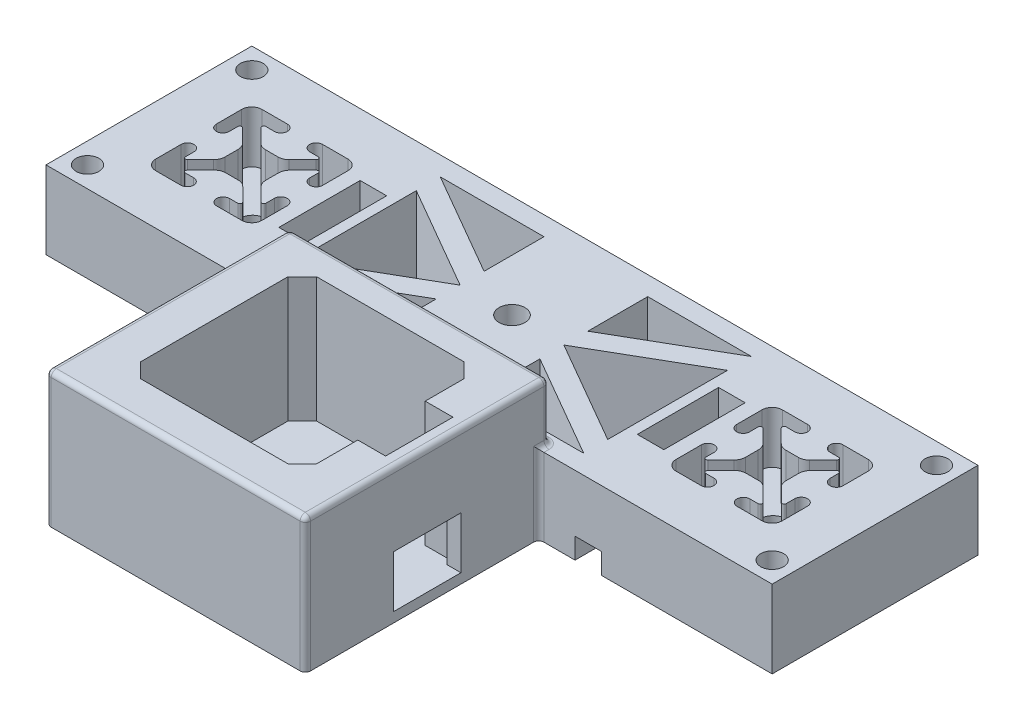
from build123d import *

# Parameters (mm, degrees)
SKETCH1_W               = 177.8
SKETCH1_H               = 50.4000008
BOSS_EXTRUDE1_DEPTH     = 6.35
SKETCH2_W               = 177.8
SKETCH2_H               = 50.4000008
BOSS_EXTRUDE2_DEPTH     = 12.7
SKETCH3_R               = 3.175
CUT_EXTRUDE1_DEPTH      = 186.784559586
CUT_EXTRUDE2_DEPTH      = 186.784559586
SKETCH5_W               = 6.5
SKETCH5_H               = 19.9
CUT_EXTRUDE3_DEPTH      = 10.2
SKETCH6_W               = 6.5
SKETCH6_H               = 4.572
CUT_EXTRUDE4_DEPTH      = 186.086574555
CUT_EXTRUDE5_DEPTH      = 186.241167349
CUT_EXTRUDE5_DEPTH_BACK = 186.241167349
SKETCH7_R               = 2.921
CUT_EXTRUDE6_DEPTH      = 186.241167349
CUT_EXTRUDE6_DEPTH_BACK = 186.241167349
SKETCH8_R               = 2.921
CHAMFER2_SIZE           = 3.302
CHAMFER3_SIZE           = 3.302
CUT_EXTRUDE8_DEPTH      = 5.08
BOSS_EXTRUDE4_DEPTH     = 33.02
CUT_EXTRUDE9_DEPTH      = 30.6
SKETCH13_W              = 16.5
SKETCH13_H              = 12.7
CUT_EXTRUDE10_DEPTH     = 30.6
FILLET1_R               = 1.27
SKETCH14_R              = 2.921
CUT_EXTRUDE11_DEPTH     = 190.249365917
SKETCH15_R              = 10.16
CUT_EXTRUDE12_DEPTH     = 8.128
SKETCH16_R              = 2.794
CUT_EXTRUDE13_DEPTH     = 188.728167838


with BuildPart() as part:
    # Sketch1 → Boss-Extrude1 (new body)
    with BuildSketch(Plane(origin=(0, 0, 0), x_dir=(1, 0, 0), z_dir=(0, 1, 0))):
        with Locations((88.9, 25.2000004)):
            Rectangle(SKETCH1_W, SKETCH1_H)
    extrude(amount=BOSS_EXTRUDE1_DEPTH)

    # Sketch2 → Boss-Extrude2 (add)
    with BuildSketch(Plane(origin=(0, 6.35, 0), x_dir=(1, 0, 0), z_dir=(0, 1, 0))):
        with Locations((88.9, 25.2000004)):
            Rectangle(SKETCH2_W, SKETCH2_H)
        with BuildLine():
            Line((38.207602115, 29.52001185), (38.207602115, 35.7371571))
            ThreePointArc((38.207602115, 35.7371571), (37.48390875, 37.484307436), (35.736758415, 38.2080008))
            Line((35.736758415, 38.2080008), (29.519613165, 38.2080008))
            ThreePointArc((29.519613165, 38.2080008), (27.941613165, 36.6300008), (29.519613165, 35.0520008))
            Line((29.519613165, 35.0520008), (31.618952135, 35.0520008))
            ThreePointArc((31.618952135, 35.0520008), (32.082805957, 34.741944038), (31.973665066, 34.194784253))
            Line((31.973665066, 34.194784253), (28.637609194, 30.863479703))
            ThreePointArc((28.637609194, 30.863479703), (27.774459736, 30.287408726), (26.756632806, 30.085138862))
            Line((26.756632806, 30.085138862), (23.642969309, 30.085138862))
            ThreePointArc((23.642969309, 30.085138862), (22.625142379, 30.287408726), (21.761992921, 30.863479703))
            Line((21.761992921, 30.863479703), (18.425937049, 34.194784253))
            ThreePointArc((18.425937049, 34.194784253), (18.316796158, 34.741944038), (18.78064998, 35.0520008))
            Line((18.78064998, 35.0520008), (20.87998895, 35.0520008))
            ThreePointArc((20.87998895, 35.0520008), (22.45798895, 36.6300008), (20.87998895, 38.2080008))
            Line((20.87998895, 38.2080008), (14.6628437, 38.2080008))
            ThreePointArc((14.6628437, 38.2080008), (12.915693364, 37.484307436), (12.192, 35.7371571))
            Line((12.192, 35.7371571), (12.192, 29.52001185))
            ThreePointArc((12.192, 29.52001185), (13.77, 27.94201185), (15.348, 29.52001185))
            Line((15.348, 29.52001185), (15.348, 31.596493464))
            ThreePointArc((15.348, 31.596493464), (15.657726258, 32.060210386), (16.204710632, 31.95171231))
            Line((16.204710632, 31.95171231), (19.406929995, 28.754053655))
            ThreePointArc((19.406929995, 28.754053655), (20.019806023, 27.837880259), (20.235040084, 26.756832148))
            Line((20.235040084, 26.756832148), (20.235040084, 23.643168652))
            ThreePointArc((20.235040084, 23.643168652), (20.019806023, 22.562120541), (19.406929995, 21.645947145))
            Line((19.406929995, 21.645947145), (16.204710632, 18.44828849))
            ThreePointArc((16.204710632, 18.44828849), (15.657726258, 18.339790414), (15.348, 18.803507336))
            Line((15.348, 18.803507336), (15.348, 20.87998895))
            ThreePointArc((15.348, 20.87998895), (13.77, 22.45798895), (12.192, 20.87998895))
            Line((12.192, 20.87998895), (12.192, 14.6628437))
            ThreePointArc((12.192, 14.6628437), (12.915693364, 12.915693364), (14.6628437, 12.192))
            Line((14.6628437, 12.192), (20.812064149, 12.192))
            ThreePointArc((20.812064149, 12.192), (22.390064149, 13.77), (20.812064149, 15.348))
            Line((20.812064149, 15.348), (18.78064998, 15.348))
            ThreePointArc((18.78064998, 15.348), (18.316796158, 15.658056762), (18.425937049, 16.205216547))
            Line((18.425937049, 16.205216547), (21.761992921, 19.536521097))
            ThreePointArc((21.761992921, 19.536521097), (22.625142379, 20.112592074), (23.642969309, 20.314861938))
            Line((23.642969309, 20.314861938), (26.756632806, 20.314861938))
            ThreePointArc((26.756632806, 20.314861938), (27.774459736, 20.112592074), (28.637609194, 19.536521097))
            Line((28.637609194, 19.536521097), (31.973665066, 16.205216547))
            ThreePointArc((31.973665066, 16.205216547), (32.082805957, 15.658056762), (31.618952135, 15.348))
            Line((31.618952135, 15.348), (29.587537966, 15.348))
            ThreePointArc((29.587537966, 15.348), (28.009537966, 13.77), (29.587537966, 12.192))
            Line((29.587537966, 12.192), (35.736758415, 12.192))
            ThreePointArc((35.736758415, 12.192), (37.48390875, 12.915693364), (38.207602115, 14.6628437))
            Line((38.207602115, 14.6628437), (38.207602115, 20.87998895))
            ThreePointArc((38.207602115, 20.87998895), (36.629602115, 22.45798895), (35.051602115, 20.87998895))
            Line((35.051602115, 20.87998895), (35.051602115, 18.803507336))
            ThreePointArc((35.051602115, 18.803507336), (34.741875857, 18.339790414), (34.194891482, 18.44828849))
            Line((34.194891482, 18.44828849), (30.99267212, 21.645947145))
            ThreePointArc((30.99267212, 21.645947145), (30.379796092, 22.562120541), (30.16456203, 23.643168652))
            Line((30.16456203, 23.643168652), (30.16456203, 26.756832148))
            ThreePointArc((30.16456203, 26.756832148), (30.379796092, 27.837880259), (30.99267212, 28.754053655))
            Line((30.99267212, 28.754053655), (34.194891482, 31.95171231))
            ThreePointArc((34.194891482, 31.95171231), (34.741875857, 32.060210386), (35.051602115, 31.596493464))
            Line((35.051602115, 31.596493464), (35.051602115, 29.52001185))
            ThreePointArc((35.051602115, 29.52001185), (36.629602115, 27.94201185), (38.207602115, 29.52001185))
        make_face(mode=Mode.SUBTRACT)
        with BuildLine():
            Line((142.748397885, 31.596493464), (142.748397885, 29.52001185))
            ThreePointArc((142.748397885, 29.52001185), (141.170397885, 27.94201185), (139.592397885, 29.52001185))
            Line((139.592397885, 29.52001185), (139.592397885, 35.7371571))
            ThreePointArc((139.592397885, 35.7371571), (140.31609125, 37.484307436), (142.063241585, 38.2080008))
            Line((142.063241585, 38.2080008), (148.280386835, 38.2080008))
            ThreePointArc((148.280386835, 38.2080008), (149.858386835, 36.6300008), (148.280386835, 35.0520008))
            Line((148.280386835, 35.0520008), (146.181047865, 35.0520008))
            ThreePointArc((146.181047865, 35.0520008), (145.717194043, 34.741944038), (145.826334934, 34.194784253))
            Line((145.826334934, 34.194784253), (149.162390806, 30.863479703))
            ThreePointArc((149.162390806, 30.863479703), (150.025540264, 30.287408726), (151.043367194, 30.085138862))
            Line((151.043367194, 30.085138862), (154.157030691, 30.085138862))
            ThreePointArc((154.157030691, 30.085138862), (155.174857621, 30.287408726), (156.038007079, 30.863479703))
            Line((156.038007079, 30.863479703), (159.374062951, 34.194784253))
            ThreePointArc((159.374062951, 34.194784253), (159.483203842, 34.741944038), (159.01935002, 35.0520008))
            Line((159.01935002, 35.0520008), (156.92001105, 35.0520008))
            ThreePointArc((156.92001105, 35.0520008), (155.34201105, 36.6300008), (156.92001105, 38.2080008))
            Line((156.92001105, 38.2080008), (163.1371563, 38.2080008))
            ThreePointArc((163.1371563, 38.2080008), (164.884306636, 37.484307436), (165.608, 35.7371571))
            Line((165.608, 35.7371571), (165.608, 29.52001185))
            ThreePointArc((165.608, 29.52001185), (164.03, 27.94201185), (162.452, 29.52001185))
            Line((162.452, 29.52001185), (162.452, 31.596493464))
            ThreePointArc((162.452, 31.596493464), (162.142273742, 32.060210386), (161.595289368, 31.95171231))
            Line((161.595289368, 31.95171231), (158.393070005, 28.754053655))
            ThreePointArc((158.393070005, 28.754053655), (157.780193977, 27.837880259), (157.564959916, 26.756832148))
            Line((157.564959916, 26.756832148), (157.564959916, 23.643168652))
            ThreePointArc((157.564959916, 23.643168652), (157.780193977, 22.562120541), (158.393070005, 21.645947145))
            Line((158.393070005, 21.645947145), (161.595289368, 18.44828849))
            ThreePointArc((161.595289368, 18.44828849), (162.142273742, 18.339790414), (162.452, 18.803507336))
            Line((162.452, 18.803507336), (162.452, 20.87998895))
            ThreePointArc((162.452, 20.87998895), (164.03, 22.45798895), (165.608, 20.87998895))
            Line((165.608, 20.87998895), (165.608, 14.6628437))
            ThreePointArc((165.608, 14.6628437), (164.884306636, 12.915693364), (163.1371563, 12.192))
            Line((163.1371563, 12.192), (156.987935851, 12.192))
            ThreePointArc((156.987935851, 12.192), (155.409935851, 13.77), (156.987935851, 15.348))
            Line((156.987935851, 15.348), (159.01935002, 15.348))
            ThreePointArc((159.01935002, 15.348), (159.483203842, 15.658056762), (159.374062951, 16.205216547))
            Line((159.374062951, 16.205216547), (156.038007079, 19.536521097))
            ThreePointArc((156.038007079, 19.536521097), (155.174857621, 20.112592074), (154.157030691, 20.314861938))
            Line((154.157030691, 20.314861938), (151.043367194, 20.314861938))
            ThreePointArc((151.043367194, 20.314861938), (150.025540264, 20.112592074), (149.162390806, 19.536521097))
            Line((149.162390806, 19.536521097), (145.826334934, 16.205216547))
            ThreePointArc((145.826334934, 16.205216547), (145.717194043, 15.658056762), (146.181047865, 15.348))
            Line((146.181047865, 15.348), (148.212462034, 15.348))
            ThreePointArc((148.212462034, 15.348), (149.790462034, 13.77), (148.212462034, 12.192))
            Line((148.212462034, 12.192), (142.063241585, 12.192))
            ThreePointArc((142.063241585, 12.192), (140.31609125, 12.915693364), (139.592397885, 14.6628437))
            Line((139.592397885, 14.6628437), (139.592397885, 20.87998895))
            ThreePointArc((139.592397885, 20.87998895), (141.170397885, 22.45798895), (142.748397885, 20.87998895))
            Line((142.748397885, 20.87998895), (142.748397885, 18.803507336))
            ThreePointArc((142.748397885, 18.803507336), (143.058124143, 18.339790414), (143.605108518, 18.44828849))
            Line((143.605108518, 18.44828849), (146.80732788, 21.645947145))
            ThreePointArc((146.80732788, 21.645947145), (147.420203908, 22.562120541), (147.63543797, 23.643168652))
            Line((147.63543797, 23.643168652), (147.63543797, 26.756832148))
            ThreePointArc((147.63543797, 26.756832148), (147.420203908, 27.837880259), (146.80732788, 28.754053655))
            Line((146.80732788, 28.754053655), (143.605108518, 31.95171231))
            ThreePointArc((143.605108518, 31.95171231), (143.058124143, 32.060210386), (142.748397885, 31.596493464))
        make_face(mode=Mode.SUBTRACT)
    extrude(amount=BOSS_EXTRUDE2_DEPTH)

    # Sketch3 → Cut-Extrude1 (cut, through all)
    with BuildSketch(Plane(origin=(0, 19.05, 0), x_dir=(1, 0, 0), z_dir=(0, 1, 0))):
        with Locations(Location((88.9, 25.2000004, 0), (0, 0, 270))):
            Circle(SKETCH3_R)
    extrude(amount=-CUT_EXTRUDE1_DEPTH, mode=Mode.SUBTRACT)

    # Sketch4 → Cut-Extrude2 (cut, through all)
    with BuildSketch(Plane(origin=(0, 19.05, 0), x_dir=(1, 0, 0), z_dir=(0, 1, 0))):
        Polygon((50.8, 45.730575972), (76.2, 45.730575972), (76.2, 31.065879135), align=None)
        Polygon((76.2, 19.334121665), (76.2, 4.669424828), (50.8, 4.669424828), align=None)
        Polygon((50.8, 39.864697237), (50.8, 10.535303563), (76.2, 25.2000004), align=None)
        Polygon((101.6, 25.2000004), (127, 39.864697237), (127, 10.535303563), align=None)
        Polygon((127, 4.669424828), (101.6, 19.334121665), (101.6, 4.669424828), align=None)
        Polygon((101.6, 31.065879135), (127, 45.730575972), (101.6, 45.730575972), align=None)
    extrude(amount=-CUT_EXTRUDE2_DEPTH, mode=Mode.SUBTRACT)

    # Sketch5 → Cut-Extrude3 (cut)
    with BuildSketch(Plane(origin=(0, 19.05, 0), x_dir=(1, 0, 0), z_dir=(0, 1, 0))):
        with Locations((45.013602115, 25.2000004)):
            Rectangle(SKETCH5_W, SKETCH5_H)
    cut_extrude3 = extrude(amount=-CUT_EXTRUDE3_DEPTH, mode=Mode.SUBTRACT)

    # Sketch6 → Cut-Extrude4 (cut, through all)
    with BuildSketch(Plane(origin=(0, 8.85, 0), x_dir=(1, 0, 0), z_dir=(0, 1, 0))):
        with Locations((45.013602115, 32.8640004)):
            Rectangle(SKETCH6_W, SKETCH6_H)
        with Locations((45.013602115, 25.2000004)):
            Rectangle(SKETCH6_W, SKETCH6_H)
        with Locations((45.013602115, 17.5360004)):
            Rectangle(SKETCH6_W, SKETCH6_H)
    cut_extrude4 = extrude(amount=-CUT_EXTRUDE4_DEPTH, mode=Mode.SUBTRACT)

    # Mirror1: Cut-Extrude3, Cut-Extrude4 across plane
    add(cut_extrude3.mirror(Plane.ZY.offset(-88.9)), mode=Mode.SUBTRACT)
    add(cut_extrude4.mirror(Plane.ZY.offset(-88.9)), mode=Mode.SUBTRACT)

    # Sketch7 → Cut-Extrude5 (cut, two sides: drawn at the far end of the back side and taken through both)
    with BuildSketch(Plane(origin=(0, 6.35, 0), x_dir=(1, 0, 0), z_dir=(0, 1, 0)).offset(-CUT_EXTRUDE5_DEPTH_BACK)):
        with Locations(Location((25.33856203, 25.259138862, 0), (0, 0, 270))):
            Circle(SKETCH7_R)
    extrude(amount=CUT_EXTRUDE5_DEPTH + CUT_EXTRUDE5_DEPTH_BACK, mode=Mode.SUBTRACT)

    # Sketch8 → Cut-Extrude6 (cut, two sides: drawn at the far end of the back side and taken through both)
    with BuildSketch(Plane(origin=(0, 6.35, 0), x_dir=(1, 0, 0), z_dir=(0, 1, 0)).offset(-CUT_EXTRUDE6_DEPTH_BACK)):
        with Locations(Location((152.738959916, 25.259138862, 0), (0, 0, 270))):
            Circle(SKETCH8_R)
    extrude(amount=CUT_EXTRUDE6_DEPTH + CUT_EXTRUDE6_DEPTH_BACK, mode=Mode.SUBTRACT)

    # Chamfer2
    chamfer2_edges = [part.edges().sort_by_distance(p)[0] for p in [
        (152.738959916, 0, -28.180138862),
    ]]
    chamfer(chamfer2_edges, length=CHAMFER2_SIZE)

    # Chamfer3
    chamfer3_edges = [part.edges().sort_by_distance(p)[0] for p in [
        (25.33856203, 0, -28.180138862),
    ]]
    chamfer(chamfer3_edges, length=CHAMFER3_SIZE)

    # Sketch11 → Cut-Extrude8 (cut)
    with BuildSketch(Plane(origin=(0, 0, 0), x_dir=(1, 0, 0), z_dir=(0, 1, 0))):
        Polygon((41.763602115, 15.2500004), (41.763602115, 0), (48.263602115, 0), (48.263602115, 15.2500004), (48.263602115, 35.1500004), (48.263602115, 50.4000008), (41.763602115, 50.4000008), (41.763602115, 35.1500004), align=None)
        Polygon((136.036397885, 0), (129.536397885, 0), (129.536397885, 15.2500004), (129.536397885, 35.1500004), (129.536397885, 50.4000008), (136.036397885, 50.4000008), (136.036397885, 35.1500004), (136.036397885, 15.2500004), align=None)
    extrude(amount=CUT_EXTRUDE8_DEPTH, mode=Mode.SUBTRACT)

    # Sketch9 → Boss-Extrude4 (add)
    with BuildSketch(Plane(origin=(0, 0, 0), x_dir=(1, 0, 0), z_dir=(0, 1, 0))):
        Polygon((120.65, 0), (120.65, -57.15), (57.15, -57.15), (57.15, 0), (57.15, 2.54), (120.65, 2.54), align=None)
    extrude(amount=BOSS_EXTRUDE4_DEPTH)

    # Sketch12 → Cut-Extrude9 (cut)
    with BuildSketch(Plane(origin=(0, 33.02, 0), x_dir=(1, 0, 0), z_dir=(0, 1, 0))):
        Polygon((70.845533906, -4.555999524), (106.954466094, -4.555999524), (110.49, -8.09153343), (110.49, -17.6419996), (117.29, -17.6419996), (117.29, -34.1419996), (110.49, -34.1419996), (110.49, -44.200465618), (106.954466094, -47.735999524), (70.845533906, -47.735999524), (67.31, -44.200465618), (67.31, -8.09153343), align=None)
    extrude(amount=-CUT_EXTRUDE9_DEPTH, mode=Mode.SUBTRACT)

    # Sketch13 → Cut-Extrude10 (cut)
    with BuildSketch(Plane(origin=(120.65, 0, 0), x_dir=(0, 0, -1), z_dir=(1, 0, 0))):
        with Locations((-27.305, 8.77)):
            Rectangle(SKETCH13_W, SKETCH13_H)
    extrude(amount=-CUT_EXTRUDE10_DEPTH, mode=Mode.SUBTRACT)

    # Fillet1
    fillet1_edges = [part.edges().sort_by_distance(p)[0] for p in [
        (120.65, 19.05, -1.27),
        (88.9, 19.05, -2.54),
        (57.15, 19.05, -1.27),
        (57.15, 9.525, 0),
        (57.15, 26.035, -2.54),
        (120.65, 9.525, 0),
        (120.65, 16.51, 57.15),
        (120.65, 26.035, -2.54),
        (57.15, 16.51, 57.15),
        (120.65, 33.02, 27.305),
        (88.9, 33.02, -2.54),
        (57.15, 33.02, 27.305),
        (88.9, 33.02, 57.15),
    ]]
    fillet(fillet1_edges, radius=FILLET1_R)

    # Sketch14 → Cut-Extrude11 (cut, through all)
    with BuildSketch(Plane(origin=(0, 2.42, 0), x_dir=(1, 0, 0), z_dir=(0, 1, 0))):
        with Locations(Location((88.9, -26.145999524, 0), (0, 0, 270))):
            Circle(SKETCH14_R)
    extrude(amount=-CUT_EXTRUDE11_DEPTH, mode=Mode.SUBTRACT)

    # Sketch15 → Cut-Extrude12 (cut)
    with BuildSketch(Plane(origin=(0, 0, 0), x_dir=(1, 0, 0), z_dir=(0, 1, 0))):
        with Locations(Location((88.9, 25.2000004, 0), (0, 0, 270))):
            Circle(SKETCH15_R)
    extrude(amount=CUT_EXTRUDE12_DEPTH, mode=Mode.SUBTRACT)

    # Sketch16 → Cut-Extrude13 (cut, through all)
    with BuildSketch(Plane(origin=(0, 19.05, 0), x_dir=(1, 0, 0), z_dir=(0, 1, 0))):
        with Locations(Location((5.08, 45.3200008, 0), (0, 0, 270))):
            Circle(SKETCH16_R)
        with Locations(Location((5.08, 5.08, 0), (0, 0, 90))):
            Circle(SKETCH16_R)
        with Locations(Location((172.72, 5.08, 0), (0, 0, 270))):
            Circle(SKETCH16_R)
        with Locations(Location((172.72, 45.3200008, 0), (0, 0, 90))):
            Circle(SKETCH16_R)
    extrude(amount=-CUT_EXTRUDE13_DEPTH, mode=Mode.SUBTRACT)


solid = part.part
